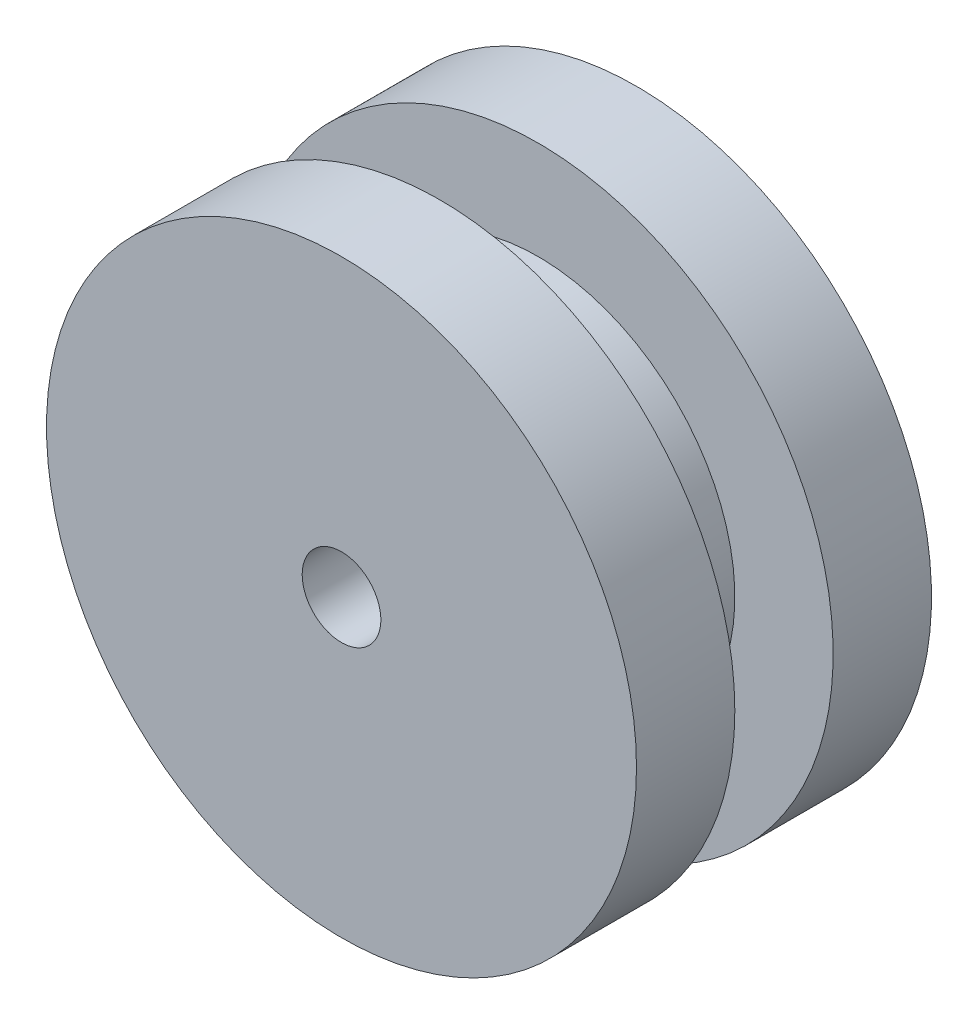
from build123d import *

# Parameters (mm, degrees)
SKETCH1_R          = 20
EXTRUDE1_DEPTH     = 5
SKETCH2_R          = 30
EXTRUDE2_DEPTH     = 10
EXTRUDE3_START     = 10
SKETCH3_R          = 30
EXTRUDE3_DEPTH     = 10
SKETCH4_R          = 4
CUT_EXTRUDE1_DEPTH = 30


with BuildPart() as part:
    # Sketch1 → Extrude1 (new, symmetric)
    with BuildSketch(Plane.XY):
        Circle(SKETCH1_R)
    extrude(amount=EXTRUDE1_DEPTH, both=True)

    # Sketch2 → Extrude2 (add)
    with BuildSketch(Plane.XY.offset(5)):
        Circle(SKETCH2_R)
    extrude(amount=EXTRUDE2_DEPTH)

    # Sketch3 → Extrude3 (add)
    with BuildSketch(Plane(origin=(0, 0, -5), x_dir=(-1, 0, 0), z_dir=(0, 0, -1)).offset(EXTRUDE3_START)):
        with Locations(Location((0, 0, 0), (0, 0, 180))):
            Circle(SKETCH3_R)
    extrude(amount=-EXTRUDE3_DEPTH)

    # Sketch4 → Cut-Extrude1 (cut)
    with BuildSketch(Plane(origin=(0, 0, -15), x_dir=(-1, 0, 0), z_dir=(0, 0, -1))):
        Circle(SKETCH4_R)
    extrude(amount=-CUT_EXTRUDE1_DEPTH, mode=Mode.SUBTRACT)


solid = part.part
